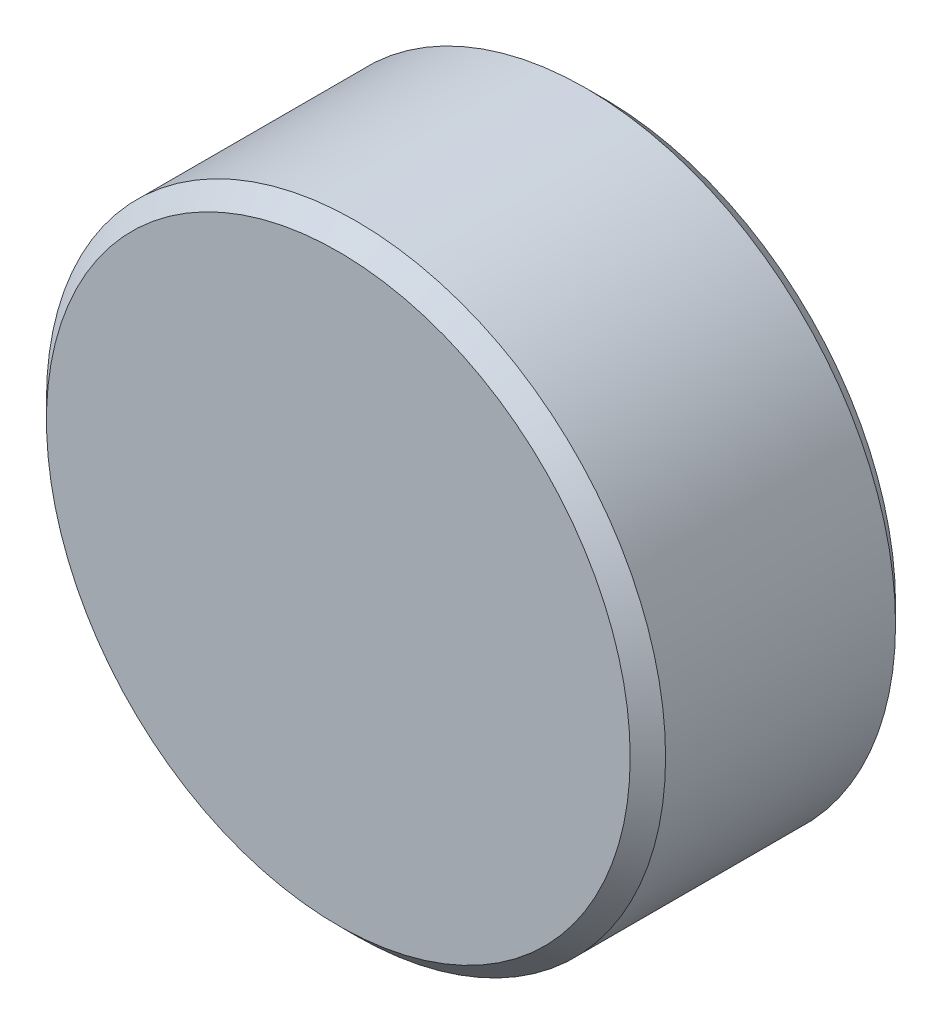
from build123d import *

# Parameters (mm, degrees)
ESQUISSE1_R      = 35
EXTRUSION1_DEPTH = 30
CHANFREIN1_SIZE  = 2
CHANFREIN2_SIZE  = 2


with BuildPart() as part:
    # Esquisse1 → Extrusion1 (new body)
    with BuildSketch(Plane.XY):
        Circle(ESQUISSE1_R)
    extrude(amount=EXTRUSION1_DEPTH)

    # Chanfrein1
    chanfrein1_edges = [part.edges().sort_by_distance(p)[0] for p in [
        (-35, 0, 30),
    ]]
    chamfer(chanfrein1_edges, length=CHANFREIN1_SIZE)

    # Chanfrein2
    chanfrein2_edges = [part.edges().sort_by_distance(p)[0] for p in [
        (-35, 0, 0),
    ]]
    chamfer(chanfrein2_edges, length=CHANFREIN2_SIZE)


solid = part.part
